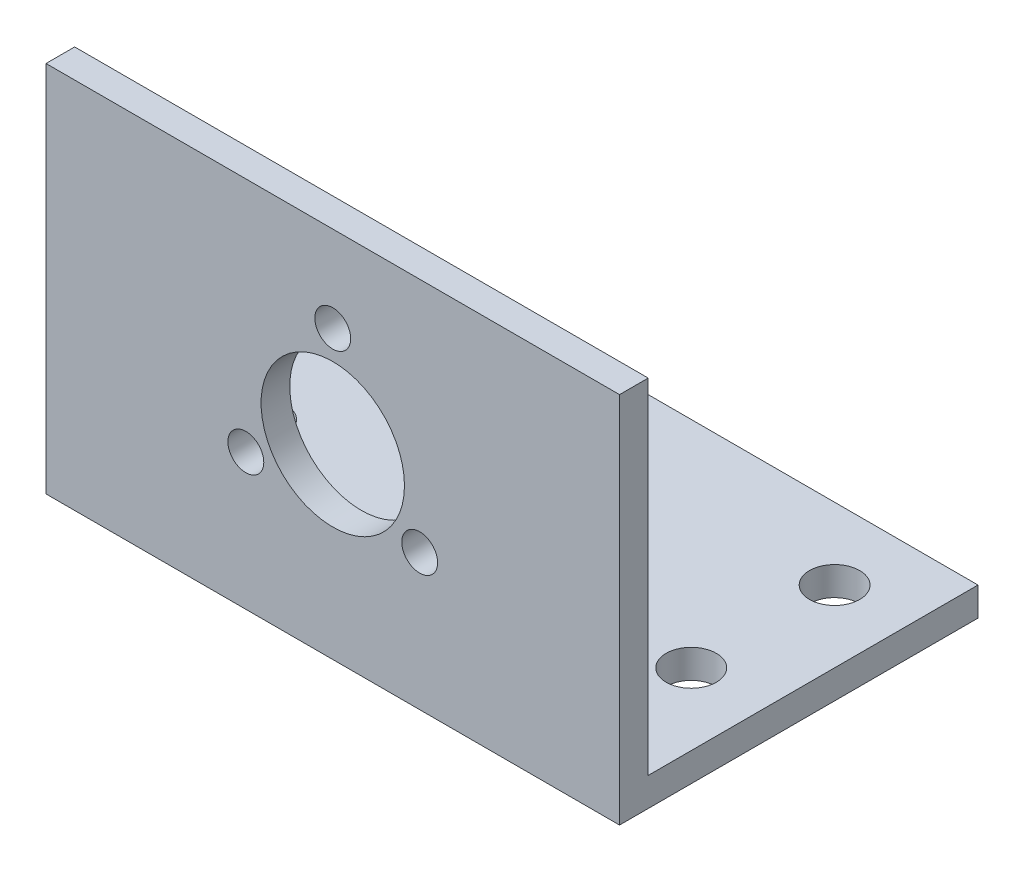
from build123d import *

# Parameters (mm, degrees)
SKETCH1_W           = 40
SKETCH1_H           = 25
BOSS_EXTRUDE1_DEPTH = 2
SKETCH2_W           = 40
SKETCH2_H           = 2
BOSS_EXTRUDE2_DEPTH = 24
SKETCH3_R           = 1.75
CUT_EXTRUDE1_DEPTH  = 36.103418637
LPATTERN1_COUNT     = 2
LPATTERN1_PITCH     = 10
SKETCH5_R           = 5
CUT_EXTRUDE2_DEPTH  = 42.243181255
SKETCH6_R           = 1.25
CUT_EXTRUDE3_DEPTH  = 42.243181255
CIRPATTERN1_COUNT   = 3


with BuildPart() as part:
    # Sketch1 → Boss-Extrude1 (new body)
    with BuildSketch(Plane(origin=(0, 0, 0), x_dir=(1, 0, 0), z_dir=(0, 1, 0))):
        Rectangle(SKETCH1_W, SKETCH1_H)
    extrude(amount=BOSS_EXTRUDE1_DEPTH)

    # Sketch2 → Boss-Extrude2 (add)
    with BuildSketch(Plane(origin=(0, 2, 0), x_dir=(1, 0, 0), z_dir=(0, 1, 0))):
        with Locations((0, -11.5)):
            Rectangle(SKETCH2_W, SKETCH2_H)
    extrude(amount=BOSS_EXTRUDE2_DEPTH)

    # Sketch3 → Cut-Extrude1 (cut, through all)
    with BuildSketch(Plane.XZ):
        with Locations(Location((-15, -7.5, 0), (0, 0, 270))):
            Circle(SKETCH3_R)
        with Locations(Location((15, -7.5, 0), (0, 0, 270))):
            Circle(SKETCH3_R)
    cut_extrude1 = extrude(amount=-CUT_EXTRUDE1_DEPTH, mode=Mode.SUBTRACT)

    # LPattern1: Cut-Extrude1 ×2
    with Locations(*[(0, 0, i * LPATTERN1_PITCH) for i in range(1, LPATTERN1_COUNT)]):
        add(cut_extrude1, mode=Mode.SUBTRACT)

    # Sketch5 → Cut-Extrude2 (cut, through all)
    with BuildSketch(Plane.XY.offset(12.5)):
        with Locations((0, 13)):
            Circle(SKETCH5_R)
    extrude(amount=-CUT_EXTRUDE2_DEPTH, mode=Mode.SUBTRACT)

    # Sketch6 → Cut-Extrude3 (cut, through all)
    with BuildSketch(Plane.XY.offset(12.5)):
        with Locations((0, 20)):
            Circle(SKETCH6_R)
    cut_extrude3 = extrude(amount=-CUT_EXTRUDE3_DEPTH, mode=Mode.SUBTRACT)

    # CirPattern1: Cut-Extrude3 ×3 about axis
    cirpattern1_axis = Axis((0, 13, 0), (0, 0, 1))
    for i in range(1, CIRPATTERN1_COUNT):
        add(cut_extrude3.rotate(cirpattern1_axis, i * 360 / CIRPATTERN1_COUNT), mode=Mode.SUBTRACT)


solid = part.part
